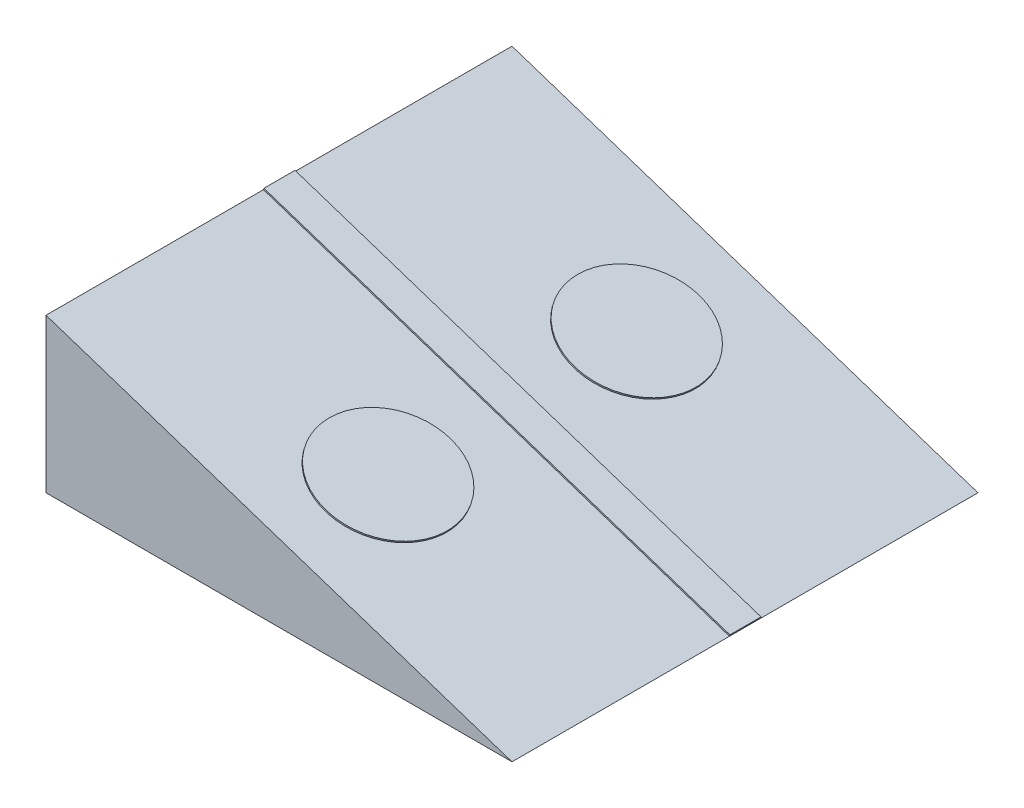
from build123d import *

# Parameters (mm, degrees)
EXTRUDE_1_DEPTH = 300
SKETCH_3_W      = 315.912962697
SKETCH_3_H      = 20
EXTRUDE_2_DEPTH = 1
SKETCH_5_R      = 40
EXTRUDE_3_DEPTH = 1
SKETCH_6_R      = 40
EXTRUDE_4_DEPTH = 1


with BuildPart() as part:
    # Эскиз1 → Бобышка-Вытянуть1 (new body)
    with BuildSketch(Plane.XY):
        Polygon((0, 0), (300, 0), (0, 99), align=None)
    extrude(amount=-EXTRUDE_1_DEPTH)

    # Эскиз3 → Бобышка-Вытянуть2 (add)
    with BuildSketch(Plane(origin=(29.461628641, 89.277662548, 0), x_dir=(0.9496286491027329, -0.3133774542039019, 0), z_dir=(0.3133774542039019, 0.9496286491027329, 0))):
        with Locations((126.932113383, 150)):
            Rectangle(SKETCH_3_W, SKETCH_3_H)
    extrude(amount=EXTRUDE_2_DEPTH)

    # Эскиз5 → Бобышка-Вытянуть3 (add)
    with BuildSketch(Plane(origin=(29.461628641, 89.277662548, 0), x_dir=(0.9496286491027329, -0.3133774542039019, 0), z_dir=(0.3133774542039019, 0.9496286491027329, 0))):
        with Locations((126.932113382, 70)):
            Circle(SKETCH_5_R)
    extrude(amount=EXTRUDE_3_DEPTH)

    # Эскиз6 → Бобышка-Вытянуть4 (add)
    with BuildSketch(Plane(origin=(29.461628641, 89.277662548, 0), x_dir=(0.9496286491027329, -0.3133774542039019, 0), z_dir=(0.3133774542039019, 0.9496286491027329, 0))):
        with Locations((126.932113382, 230)):
            Circle(SKETCH_6_R)
    extrude(amount=EXTRUDE_4_DEPTH)


solid = part.part
